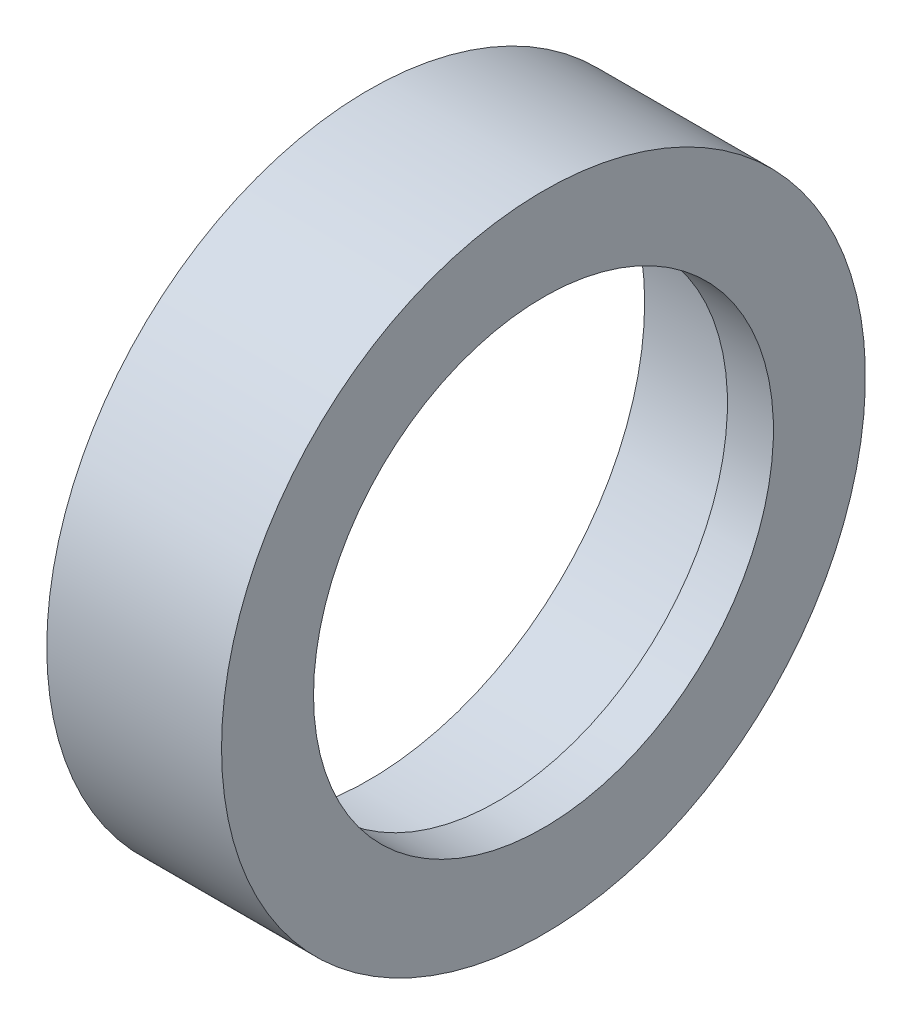
from build123d import *


with BuildPart() as part:
    # Sketch1 → Revolve1 (revolve)
    with BuildSketch(Plane.XY, mode=Mode.PRIVATE) as revolve1_sk:
        Polygon((-19, 35), (-19, 30), (-5, 30), (-5, 25), (0, 25), (0, 35), align=None)
    revolve(revolve1_sk.sketch.rotate(Axis((-15.372662967, 0, 0), (1, 0, 0)), 90), axis=Axis((-15.372662967, 0, 0), (1, 0, 0)))


solid = part.part
